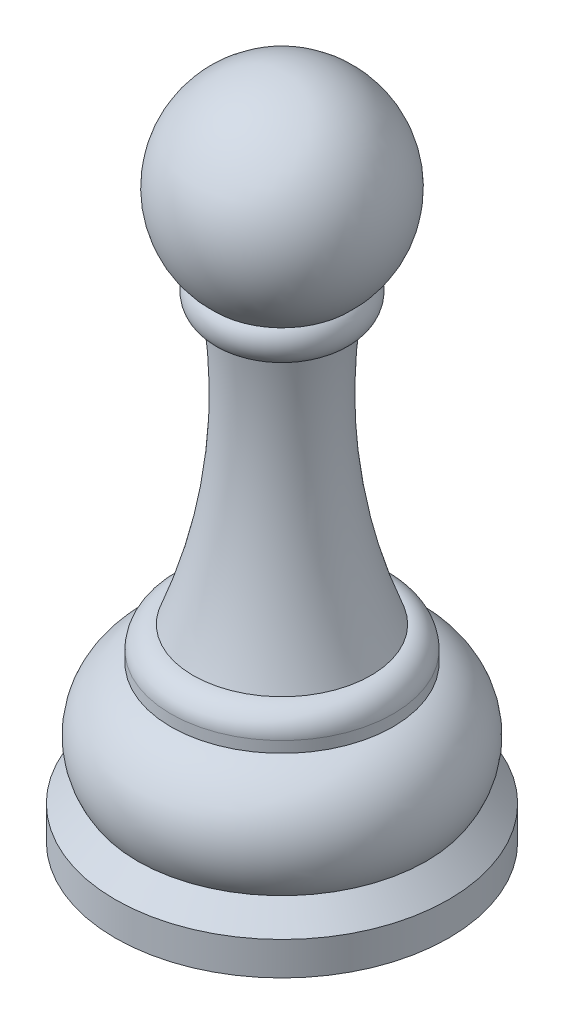
from build123d import *


with BuildPart() as part:
    # Çizim1 → Döndür1 (revolve)
    with BuildSketch(Plane.XY, mode=Mode.PRIVATE) as d_nd_r1_sk:
        with BuildLine():
            Line((0, 0), (-15, 0))
            Line((-15, 0), (-15, 3))
            Line((-15, 3), (-13, 5))
            ThreePointArc((-13, 5), (-13.688325627, 10.216881481), (-10, 13.97))
            Line((-10, 13.97), (-10, 14.97))
            ThreePointArc((-10, 14.97), (-9.414213562, 16.384213562), (-8, 16.97))
            ThreePointArc((-8, 16.97), (-5.015767327, 28.825089026), (-4.997543238, 41.05))
            ThreePointArc((-4.997543238, 41.05), (-6.411660207, 42.399284866), (-6, 44.31))
            ThreePointArc((-6, 44.31), (-8.407551231, 54.22960274), (0, 60.018203932))
            Line((0, 60.018203932), (0, 0))
        make_face()
    revolve(d_nd_r1_sk.sketch.rotate(Axis((0, 102.341178824, 0), (0, -1, 0)), 270), axis=Axis((0, 102.341178824, 0), (0, -1, 0)))


solid = part.part
